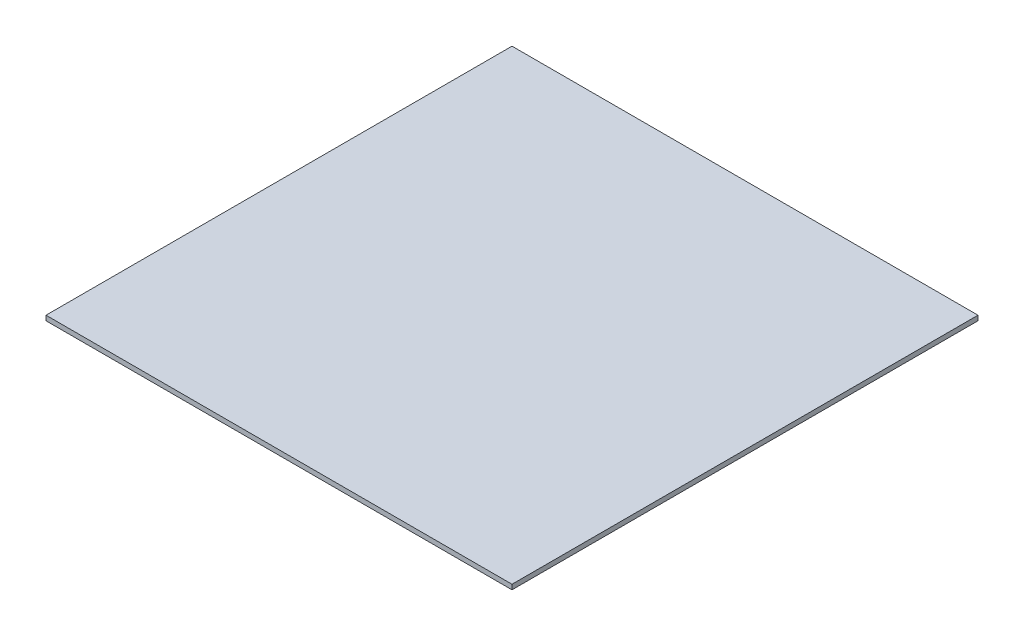
from build123d import *

# Parameters (mm, degrees)
SKETCH1_W           = 609.6
SKETCH1_H           = 609.6
BOSS_EXTRUDE1_DEPTH = 6.35


with BuildPart() as part:
    # Sketch1 → Boss-Extrude1 (new body)
    with BuildSketch(Plane(origin=(0, 0, 0), x_dir=(1, 0, 0), z_dir=(0, 1, 0))):
        with Locations((-82.357575758, -23.090909091)):
            Rectangle(SKETCH1_W, SKETCH1_H)
    extrude(amount=BOSS_EXTRUDE1_DEPTH)


solid = part.part
